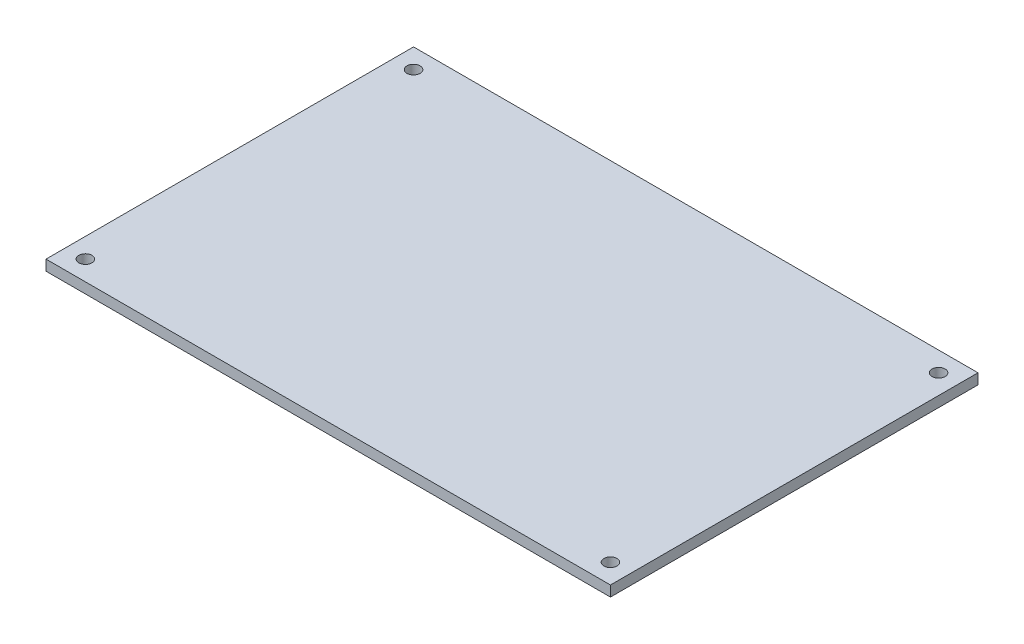
from build123d import *

# Parameters (mm, degrees)
SKETCH_2_W      = 86
SKETCH_2_H      = 56
SKETCH_2_R      = 1
EXTRUDE_1_DEPTH = 1.6


with BuildPart() as part:
    # 草图2 → 凸台-拉伸1 (new body)
    with BuildSketch(Plane(origin=(0, 0, 0), x_dir=(1, 0, 0), z_dir=(0, 1, 0))):
        Rectangle(SKETCH_2_W, SKETCH_2_H)
        with Locations(Location((-40, 25, 0), (0, 0, 270))):
            Circle(SKETCH_2_R, mode=Mode.SUBTRACT)
        with Locations(Location((40, 25, 0), (0, 0, 90))):
            Circle(SKETCH_2_R, mode=Mode.SUBTRACT)
        with Locations(Location((40, -25, 0), (0, 0, 270))):
            Circle(SKETCH_2_R, mode=Mode.SUBTRACT)
        with Locations(Location((-40, -25, 0), (0, 0, 90))):
            Circle(SKETCH_2_R, mode=Mode.SUBTRACT)
    extrude(amount=EXTRUDE_1_DEPTH)


solid = part.part
